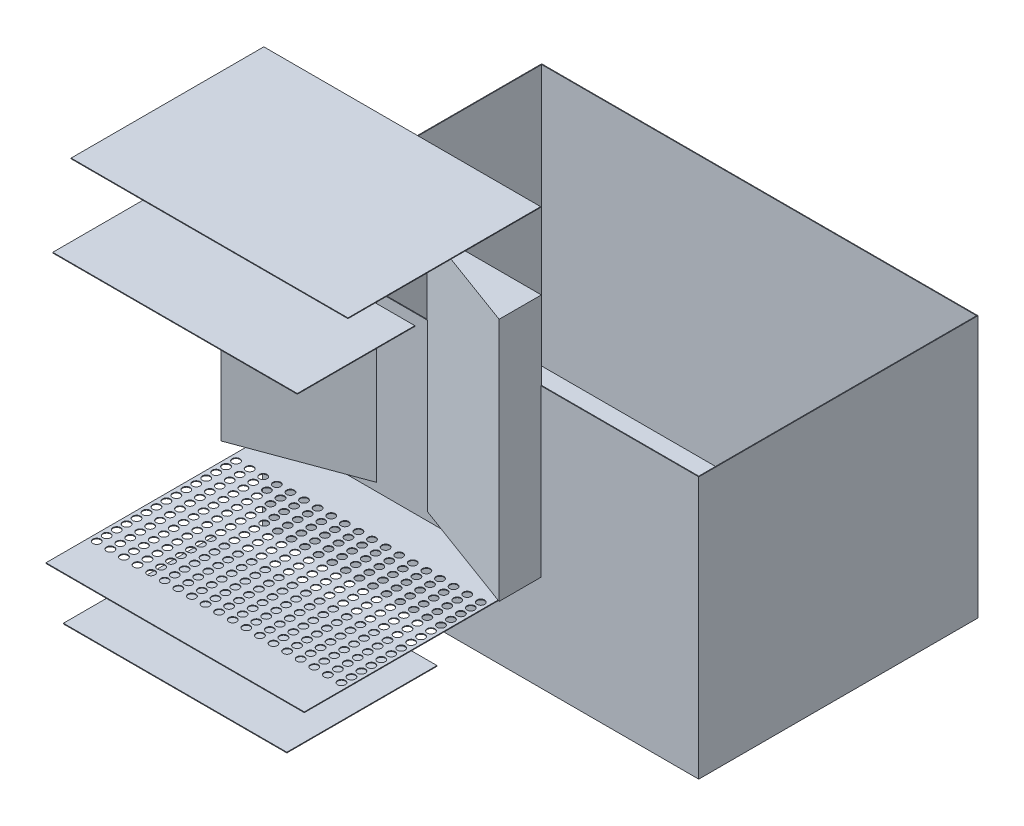
from build123d import *

# Parameters (mm, degrees)
MASTER_FOOTPRINT_W            = 1250
MASTER_FOOTPRINT_H            = 800
BATH_BASE_PLATE_DEPTH         = 750
BATH_SHELL_2MM_T              = -2
INLET_IMPACT_BAFFLE_START     = 125
SKETCH_1_W                    = 640
SKETCH_1_H                    = 430
INLET_IMPACT_BAFFLE_DEPTH     = 2
DISTRIBUTOR_D22_START         = 250
SKETCH_2_W                    = 740
SKETCH_2_H                    = 652
SKETCH_2_R                    = 11
DISTRIBUTOR_D22_DEPTH         = 2
OUTLET_SUBMERGED_BAFFLE_START = 1030
SKETCH_3_W                    = 700.526315789
SKETCH_3_H                    = 336.5
OUTLET_SUBMERGED_BAFFLE_DEPTH = 2
OVERFLOW_WEIR_Z550_START      = 1190
SKETCH_4_W                    = 793
SKETCH_4_H                    = 552
OVERFLOW_WEIR_Z550_DEPTH      = 2
SLOPED_SEDIMENT_FLOOR_START   = 275
SLOPED_SEDIMENT_FLOOR_DEPTH   = 700


with BuildPart() as part:
    # MASTER_FOOTPRINT → BATH_BASE_PLATE (new body)
    with BuildSketch(Plane(origin=(0, 0, 0), x_dir=(1, 0, 0), z_dir=(0, 1, 0))):
        with Locations((625, 400)):
            Rectangle(MASTER_FOOTPRINT_W, MASTER_FOOTPRINT_H)
    extrude(amount=BATH_BASE_PLATE_DEPTH)

    # BATH_SHELL_2MM
    bath_shell_2mm_openings = [part.faces().sort_by_distance(p)[0] for p in [
        (625, 750, -400),
    ]]
    offset(amount=BATH_SHELL_2MM_T, openings=bath_shell_2mm_openings, kind=Kind.INTERSECTION)

    # Эскиз5 → SLOPED_SEDIMENT_FLOOR (add)
    with BuildSketch(Plane(origin=(0, 0, 0), x_dir=(1, 0, 0), z_dir=(0, 1, 0)).offset(SLOPED_SEDIMENT_FLOOR_START)):
        Polygon((2, 1), (2, -120), (330, 1), align=None)
        Polygon((798, 1), (798, -120), (470, 1), align=None)
    extrude(amount=SLOPED_SEDIMENT_FLOOR_DEPTH)


with BuildPart() as body_2:
    # Эскиз1 → INLET_IMPACT_BAFFLE (new body)
    with BuildSketch(Plane(origin=(0, 0, 0), x_dir=(1, 0, 0), z_dir=(0, 1, 0)).offset(INLET_IMPACT_BAFFLE_START)):
        with Locations((400, -435)):
            Rectangle(SKETCH_1_W, SKETCH_1_H)
    extrude(amount=INLET_IMPACT_BAFFLE_DEPTH)


with BuildPart() as body_3:
    # Эскиз2 → DISTRIBUTOR_D22 (new body)
    with BuildSketch(Plane(origin=(0, 0, 0), x_dir=(1, 0, 0), z_dir=(0, 1, 0)).offset(DISTRIBUTOR_D22_START)):
        with Locations((400, -324)):
            Rectangle(SKETCH_2_W, SKETCH_2_H)
        with Locations(Location((49.473684211, -125, 0), (0, 0, 270))):
            Circle(SKETCH_2_R, mode=Mode.SUBTRACT)
        with Locations(Location((49.473684211, -153.5, 0), (0, 0, 270))):
            Circle(SKETCH_2_R, mode=Mode.SUBTRACT)
        with Locations(Location((49.473684211, -182, 0), (0, 0, 270))):
            Circle(SKETCH_2_R, mode=Mode.SUBTRACT)
        with Locations(Location((49.473684211, -210.5, 0), (0, 0, 270))):
            Circle(SKETCH_2_R, mode=Mode.SUBTRACT)
        with Locations(Location((49.473684211, -239, 0), (0, 0, 270))):
            Circle(SKETCH_2_R, mode=Mode.SUBTRACT)
        with Locations(Location((49.473684211, -267.5, 0), (0, 0, 270))):
            Circle(SKETCH_2_R, mode=Mode.SUBTRACT)
        with Locations(Location((49.473684211, -296, 0), (0, 0, 270))):
            Circle(SKETCH_2_R, mode=Mode.SUBTRACT)
        with Locations(Location((49.473684211, -324.5, 0), (0, 0, 270))):
            Circle(SKETCH_2_R, mode=Mode.SUBTRACT)
        with Locations(Location((49.473684211, -353, 0), (0, 0, 270))):
            Circle(SKETCH_2_R, mode=Mode.SUBTRACT)
        with Locations(Location((49.473684211, -381.5, 0), (0, 0, 270))):
            Circle(SKETCH_2_R, mode=Mode.SUBTRACT)
        with Locations(Location((49.473684211, -410, 0), (0, 0, 270))):
            Circle(SKETCH_2_R, mode=Mode.SUBTRACT)
        with Locations(Location((49.473684211, -438.5, 0), (0, 0, 270))):
            Circle(SKETCH_2_R, mode=Mode.SUBTRACT)
        with Locations(Location((49.473684211, -467, 0), (0, 0, 270))):
            Circle(SKETCH_2_R, mode=Mode.SUBTRACT)
        with Locations(Location((49.473684211, -495.5, 0), (0, 0, 270))):
            Circle(SKETCH_2_R, mode=Mode.SUBTRACT)
        with Locations(Location((49.473684211, -524, 0), (0, 0, 270))):
            Circle(SKETCH_2_R, mode=Mode.SUBTRACT)
        with Locations(Location((88.421052632, -125, 0), (0, 0, 270))):
            Circle(SKETCH_2_R, mode=Mode.SUBTRACT)
        with Locations(Location((88.421052632, -153.5, 0), (0, 0, 270))):
            Circle(SKETCH_2_R, mode=Mode.SUBTRACT)
        with Locations(Location((88.421052632, -182, 0), (0, 0, 270))):
            Circle(SKETCH_2_R, mode=Mode.SUBTRACT)
        with Locations(Location((88.421052632, -210.5, 0), (0, 0, 270))):
            Circle(SKETCH_2_R, mode=Mode.SUBTRACT)
        with Locations(Location((88.421052632, -239, 0), (0, 0, 270))):
            Circle(SKETCH_2_R, mode=Mode.SUBTRACT)
        with Locations(Location((88.421052632, -267.5, 0), (0, 0, 270))):
            Circle(SKETCH_2_R, mode=Mode.SUBTRACT)
        with Locations(Location((88.421052632, -296, 0), (0, 0, 270))):
            Circle(SKETCH_2_R, mode=Mode.SUBTRACT)
        with Locations(Location((88.421052632, -324.5, 0), (0, 0, 270))):
            Circle(SKETCH_2_R, mode=Mode.SUBTRACT)
        with Locations(Location((88.421052632, -353, 0), (0, 0, 270))):
            Circle(SKETCH_2_R, mode=Mode.SUBTRACT)
        with Locations(Location((88.421052632, -381.5, 0), (0, 0, 270))):
            Circle(SKETCH_2_R, mode=Mode.SUBTRACT)
        with Locations(Location((88.421052632, -410, 0), (0, 0, 270))):
            Circle(SKETCH_2_R, mode=Mode.SUBTRACT)
        with Locations(Location((88.421052632, -438.5, 0), (0, 0, 270))):
            Circle(SKETCH_2_R, mode=Mode.SUBTRACT)
        with Locations(Location((88.421052632, -467, 0), (0, 0, 270))):
            Circle(SKETCH_2_R, mode=Mode.SUBTRACT)
        with Locations(Location((88.421052632, -495.5, 0), (0, 0, 270))):
            Circle(SKETCH_2_R, mode=Mode.SUBTRACT)
        with Locations(Location((88.421052632, -524, 0), (0, 0, 270))):
            Circle(SKETCH_2_R, mode=Mode.SUBTRACT)
        with Locations(Location((127.368421053, -125, 0), (0, 0, 270))):
            Circle(SKETCH_2_R, mode=Mode.SUBTRACT)
        with Locations(Location((127.368421053, -153.5, 0), (0, 0, 270))):
            Circle(SKETCH_2_R, mode=Mode.SUBTRACT)
        with Locations(Location((127.368421053, -182, 0), (0, 0, 270))):
            Circle(SKETCH_2_R, mode=Mode.SUBTRACT)
        with Locations(Location((127.368421053, -210.5, 0), (0, 0, 270))):
            Circle(SKETCH_2_R, mode=Mode.SUBTRACT)
        with Locations(Location((127.368421053, -239, 0), (0, 0, 270))):
            Circle(SKETCH_2_R, mode=Mode.SUBTRACT)
        with Locations(Location((127.368421053, -267.5, 0), (0, 0, 270))):
            Circle(SKETCH_2_R, mode=Mode.SUBTRACT)
        with Locations(Location((127.368421053, -296, 0), (0, 0, 270))):
            Circle(SKETCH_2_R, mode=Mode.SUBTRACT)
        with Locations(Location((127.368421053, -324.5, 0), (0, 0, 270))):
            Circle(SKETCH_2_R, mode=Mode.SUBTRACT)
        with Locations(Location((127.368421053, -353, 0), (0, 0, 270))):
            Circle(SKETCH_2_R, mode=Mode.SUBTRACT)
        with Locations(Location((127.368421053, -381.5, 0), (0, 0, 270))):
            Circle(SKETCH_2_R, mode=Mode.SUBTRACT)
        with Locations(Location((127.368421053, -410, 0), (0, 0, 270))):
            Circle(SKETCH_2_R, mode=Mode.SUBTRACT)
        with Locations(Location((127.368421053, -438.5, 0), (0, 0, 270))):
            Circle(SKETCH_2_R, mode=Mode.SUBTRACT)
        with Locations(Location((127.368421053, -467, 0), (0, 0, 270))):
            Circle(SKETCH_2_R, mode=Mode.SUBTRACT)
        with Locations(Location((127.368421053, -495.5, 0), (0, 0, 270))):
            Circle(SKETCH_2_R, mode=Mode.SUBTRACT)
        with Locations(Location((127.368421053, -524, 0), (0, 0, 270))):
            Circle(SKETCH_2_R, mode=Mode.SUBTRACT)
        with Locations(Location((166.315789474, -125, 0), (0, 0, 270))):
            Circle(SKETCH_2_R, mode=Mode.SUBTRACT)
        with Locations(Location((166.315789474, -153.5, 0), (0, 0, 270))):
            Circle(SKETCH_2_R, mode=Mode.SUBTRACT)
        with Locations(Location((166.315789474, -182, 0), (0, 0, 270))):
            Circle(SKETCH_2_R, mode=Mode.SUBTRACT)
        with Locations(Location((166.315789474, -210.5, 0), (0, 0, 270))):
            Circle(SKETCH_2_R, mode=Mode.SUBTRACT)
        with Locations(Location((166.315789474, -239, 0), (0, 0, 270))):
            Circle(SKETCH_2_R, mode=Mode.SUBTRACT)
        with Locations(Location((166.315789474, -267.5, 0), (0, 0, 270))):
            Circle(SKETCH_2_R, mode=Mode.SUBTRACT)
        with Locations(Location((166.315789474, -296, 0), (0, 0, 270))):
            Circle(SKETCH_2_R, mode=Mode.SUBTRACT)
        with Locations(Location((166.315789474, -324.5, 0), (0, 0, 270))):
            Circle(SKETCH_2_R, mode=Mode.SUBTRACT)
        with Locations(Location((166.315789474, -353, 0), (0, 0, 270))):
            Circle(SKETCH_2_R, mode=Mode.SUBTRACT)
        with Locations(Location((166.315789474, -381.5, 0), (0, 0, 270))):
            Circle(SKETCH_2_R, mode=Mode.SUBTRACT)
        with Locations(Location((166.315789474, -410, 0), (0, 0, 270))):
            Circle(SKETCH_2_R, mode=Mode.SUBTRACT)
        with Locations(Location((166.315789474, -438.5, 0), (0, 0, 270))):
            Circle(SKETCH_2_R, mode=Mode.SUBTRACT)
        with Locations(Location((166.315789474, -467, 0), (0, 0, 270))):
            Circle(SKETCH_2_R, mode=Mode.SUBTRACT)
        with Locations(Location((166.315789474, -495.5, 0), (0, 0, 270))):
            Circle(SKETCH_2_R, mode=Mode.SUBTRACT)
        with Locations(Location((166.315789474, -524, 0), (0, 0, 270))):
            Circle(SKETCH_2_R, mode=Mode.SUBTRACT)
        with Locations(Location((205.263157895, -125, 0), (0, 0, 270))):
            Circle(SKETCH_2_R, mode=Mode.SUBTRACT)
        with Locations(Location((205.263157895, -153.5, 0), (0, 0, 270))):
            Circle(SKETCH_2_R, mode=Mode.SUBTRACT)
        with Locations(Location((205.263157895, -182, 0), (0, 0, 270))):
            Circle(SKETCH_2_R, mode=Mode.SUBTRACT)
        with Locations(Location((205.263157895, -210.5, 0), (0, 0, 270))):
            Circle(SKETCH_2_R, mode=Mode.SUBTRACT)
        with Locations(Location((205.263157895, -239, 0), (0, 0, 270))):
            Circle(SKETCH_2_R, mode=Mode.SUBTRACT)
        with Locations(Location((205.263157895, -267.5, 0), (0, 0, 270))):
            Circle(SKETCH_2_R, mode=Mode.SUBTRACT)
        with Locations(Location((205.263157895, -296, 0), (0, 0, 270))):
            Circle(SKETCH_2_R, mode=Mode.SUBTRACT)
        with Locations(Location((205.263157895, -324.5, 0), (0, 0, 270))):
            Circle(SKETCH_2_R, mode=Mode.SUBTRACT)
        with Locations(Location((205.263157895, -353, 0), (0, 0, 270))):
            Circle(SKETCH_2_R, mode=Mode.SUBTRACT)
        with Locations(Location((205.263157895, -381.5, 0), (0, 0, 270))):
            Circle(SKETCH_2_R, mode=Mode.SUBTRACT)
        with Locations(Location((205.263157895, -410, 0), (0, 0, 270))):
            Circle(SKETCH_2_R, mode=Mode.SUBTRACT)
        with Locations(Location((205.263157895, -438.5, 0), (0, 0, 270))):
            Circle(SKETCH_2_R, mode=Mode.SUBTRACT)
        with Locations(Location((205.263157895, -467, 0), (0, 0, 270))):
            Circle(SKETCH_2_R, mode=Mode.SUBTRACT)
        with Locations(Location((205.263157895, -495.5, 0), (0, 0, 270))):
            Circle(SKETCH_2_R, mode=Mode.SUBTRACT)
        with Locations(Location((205.263157895, -524, 0), (0, 0, 270))):
            Circle(SKETCH_2_R, mode=Mode.SUBTRACT)
        with Locations(Location((244.210526316, -125, 0), (0, 0, 270))):
            Circle(SKETCH_2_R, mode=Mode.SUBTRACT)
        with Locations(Location((244.210526316, -153.5, 0), (0, 0, 270))):
            Circle(SKETCH_2_R, mode=Mode.SUBTRACT)
        with Locations(Location((244.210526316, -182, 0), (0, 0, 270))):
            Circle(SKETCH_2_R, mode=Mode.SUBTRACT)
        with Locations(Location((244.210526316, -210.5, 0), (0, 0, 270))):
            Circle(SKETCH_2_R, mode=Mode.SUBTRACT)
        with Locations(Location((244.210526316, -239, 0), (0, 0, 270))):
            Circle(SKETCH_2_R, mode=Mode.SUBTRACT)
        with Locations(Location((244.210526316, -267.5, 0), (0, 0, 270))):
            Circle(SKETCH_2_R, mode=Mode.SUBTRACT)
        with Locations(Location((244.210526316, -296, 0), (0, 0, 270))):
            Circle(SKETCH_2_R, mode=Mode.SUBTRACT)
        with Locations(Location((244.210526316, -324.5, 0), (0, 0, 270))):
            Circle(SKETCH_2_R, mode=Mode.SUBTRACT)
        with Locations(Location((244.210526316, -353, 0), (0, 0, 270))):
            Circle(SKETCH_2_R, mode=Mode.SUBTRACT)
        with Locations(Location((244.210526316, -381.5, 0), (0, 0, 270))):
            Circle(SKETCH_2_R, mode=Mode.SUBTRACT)
        with Locations(Location((244.210526316, -410, 0), (0, 0, 270))):
            Circle(SKETCH_2_R, mode=Mode.SUBTRACT)
        with Locations(Location((244.210526316, -438.5, 0), (0, 0, 270))):
            Circle(SKETCH_2_R, mode=Mode.SUBTRACT)
        with Locations(Location((244.210526316, -467, 0), (0, 0, 270))):
            Circle(SKETCH_2_R, mode=Mode.SUBTRACT)
        with Locations(Location((244.210526316, -495.5, 0), (0, 0, 270))):
            Circle(SKETCH_2_R, mode=Mode.SUBTRACT)
        with Locations(Location((244.210526316, -524, 0), (0, 0, 270))):
            Circle(SKETCH_2_R, mode=Mode.SUBTRACT)
        with Locations(Location((283.157894737, -125, 0), (0, 0, 270))):
            Circle(SKETCH_2_R, mode=Mode.SUBTRACT)
        with Locations(Location((283.157894737, -153.5, 0), (0, 0, 270))):
            Circle(SKETCH_2_R, mode=Mode.SUBTRACT)
        with Locations(Location((283.157894737, -182, 0), (0, 0, 270))):
            Circle(SKETCH_2_R, mode=Mode.SUBTRACT)
        with Locations(Location((283.157894737, -210.5, 0), (0, 0, 270))):
            Circle(SKETCH_2_R, mode=Mode.SUBTRACT)
        with Locations(Location((283.157894737, -239, 0), (0, 0, 270))):
            Circle(SKETCH_2_R, mode=Mode.SUBTRACT)
        with Locations(Location((283.157894737, -267.5, 0), (0, 0, 270))):
            Circle(SKETCH_2_R, mode=Mode.SUBTRACT)
        with Locations(Location((283.157894737, -296, 0), (0, 0, 270))):
            Circle(SKETCH_2_R, mode=Mode.SUBTRACT)
        with Locations(Location((283.157894737, -324.5, 0), (0, 0, 270))):
            Circle(SKETCH_2_R, mode=Mode.SUBTRACT)
        with Locations(Location((283.157894737, -353, 0), (0, 0, 270))):
            Circle(SKETCH_2_R, mode=Mode.SUBTRACT)
        with Locations(Location((283.157894737, -381.5, 0), (0, 0, 270))):
            Circle(SKETCH_2_R, mode=Mode.SUBTRACT)
        with Locations(Location((283.157894737, -410, 0), (0, 0, 270))):
            Circle(SKETCH_2_R, mode=Mode.SUBTRACT)
        with Locations(Location((283.157894737, -438.5, 0), (0, 0, 270))):
            Circle(SKETCH_2_R, mode=Mode.SUBTRACT)
        with Locations(Location((283.157894737, -467, 0), (0, 0, 270))):
            Circle(SKETCH_2_R, mode=Mode.SUBTRACT)
        with Locations(Location((283.157894737, -495.5, 0), (0, 0, 270))):
            Circle(SKETCH_2_R, mode=Mode.SUBTRACT)
        with Locations(Location((283.157894737, -524, 0), (0, 0, 270))):
            Circle(SKETCH_2_R, mode=Mode.SUBTRACT)
        with Locations(Location((322.105263158, -125, 0), (0, 0, 270))):
            Circle(SKETCH_2_R, mode=Mode.SUBTRACT)
        with Locations(Location((322.105263158, -153.5, 0), (0, 0, 270))):
            Circle(SKETCH_2_R, mode=Mode.SUBTRACT)
        with Locations(Location((322.105263158, -182, 0), (0, 0, 270))):
            Circle(SKETCH_2_R, mode=Mode.SUBTRACT)
        with Locations(Location((322.105263158, -210.5, 0), (0, 0, 270))):
            Circle(SKETCH_2_R, mode=Mode.SUBTRACT)
        with Locations(Location((322.105263158, -239, 0), (0, 0, 270))):
            Circle(SKETCH_2_R, mode=Mode.SUBTRACT)
        with Locations(Location((322.105263158, -267.5, 0), (0, 0, 270))):
            Circle(SKETCH_2_R, mode=Mode.SUBTRACT)
        with Locations(Location((322.105263158, -296, 0), (0, 0, 270))):
            Circle(SKETCH_2_R, mode=Mode.SUBTRACT)
        with Locations(Location((322.105263158, -324.5, 0), (0, 0, 270))):
            Circle(SKETCH_2_R, mode=Mode.SUBTRACT)
        with Locations(Location((322.105263158, -353, 0), (0, 0, 270))):
            Circle(SKETCH_2_R, mode=Mode.SUBTRACT)
        with Locations(Location((322.105263158, -381.5, 0), (0, 0, 270))):
            Circle(SKETCH_2_R, mode=Mode.SUBTRACT)
        with Locations(Location((322.105263158, -410, 0), (0, 0, 270))):
            Circle(SKETCH_2_R, mode=Mode.SUBTRACT)
        with Locations(Location((322.105263158, -438.5, 0), (0, 0, 270))):
            Circle(SKETCH_2_R, mode=Mode.SUBTRACT)
        with Locations(Location((322.105263158, -467, 0), (0, 0, 270))):
            Circle(SKETCH_2_R, mode=Mode.SUBTRACT)
        with Locations(Location((322.105263158, -495.5, 0), (0, 0, 270))):
            Circle(SKETCH_2_R, mode=Mode.SUBTRACT)
        with Locations(Location((322.105263158, -524, 0), (0, 0, 270))):
            Circle(SKETCH_2_R, mode=Mode.SUBTRACT)
        with Locations(Location((361.052631579, -125, 0), (0, 0, 270))):
            Circle(SKETCH_2_R, mode=Mode.SUBTRACT)
        with Locations(Location((361.052631579, -153.5, 0), (0, 0, 270))):
            Circle(SKETCH_2_R, mode=Mode.SUBTRACT)
        with Locations(Location((361.052631579, -182, 0), (0, 0, 270))):
            Circle(SKETCH_2_R, mode=Mode.SUBTRACT)
        with Locations(Location((361.052631579, -210.5, 0), (0, 0, 270))):
            Circle(SKETCH_2_R, mode=Mode.SUBTRACT)
        with Locations(Location((361.052631579, -239, 0), (0, 0, 270))):
            Circle(SKETCH_2_R, mode=Mode.SUBTRACT)
        with Locations(Location((361.052631579, -267.5, 0), (0, 0, 270))):
            Circle(SKETCH_2_R, mode=Mode.SUBTRACT)
        with Locations(Location((361.052631579, -296, 0), (0, 0, 270))):
            Circle(SKETCH_2_R, mode=Mode.SUBTRACT)
        with Locations(Location((361.052631579, -324.5, 0), (0, 0, 270))):
            Circle(SKETCH_2_R, mode=Mode.SUBTRACT)
        with Locations(Location((361.052631579, -353, 0), (0, 0, 270))):
            Circle(SKETCH_2_R, mode=Mode.SUBTRACT)
        with Locations(Location((361.052631579, -381.5, 0), (0, 0, 270))):
            Circle(SKETCH_2_R, mode=Mode.SUBTRACT)
        with Locations(Location((361.052631579, -410, 0), (0, 0, 270))):
            Circle(SKETCH_2_R, mode=Mode.SUBTRACT)
        with Locations(Location((361.052631579, -438.5, 0), (0, 0, 270))):
            Circle(SKETCH_2_R, mode=Mode.SUBTRACT)
        with Locations(Location((361.052631579, -467, 0), (0, 0, 270))):
            Circle(SKETCH_2_R, mode=Mode.SUBTRACT)
        with Locations(Location((361.052631579, -495.5, 0), (0, 0, 270))):
            Circle(SKETCH_2_R, mode=Mode.SUBTRACT)
        with Locations(Location((361.052631579, -524, 0), (0, 0, 270))):
            Circle(SKETCH_2_R, mode=Mode.SUBTRACT)
        with Locations(Location((400, -125, 0), (0, 0, 270))):
            Circle(SKETCH_2_R, mode=Mode.SUBTRACT)
        with Locations(Location((400, -153.5, 0), (0, 0, 270))):
            Circle(SKETCH_2_R, mode=Mode.SUBTRACT)
        with Locations(Location((400, -182, 0), (0, 0, 270))):
            Circle(SKETCH_2_R, mode=Mode.SUBTRACT)
        with Locations(Location((400, -210.5, 0), (0, 0, 270))):
            Circle(SKETCH_2_R, mode=Mode.SUBTRACT)
        with Locations(Location((400, -239, 0), (0, 0, 270))):
            Circle(SKETCH_2_R, mode=Mode.SUBTRACT)
        with Locations(Location((400, -267.5, 0), (0, 0, 270))):
            Circle(SKETCH_2_R, mode=Mode.SUBTRACT)
        with Locations(Location((400, -296, 0), (0, 0, 270))):
            Circle(SKETCH_2_R, mode=Mode.SUBTRACT)
        with Locations(Location((400, -324.5, 0), (0, 0, 270))):
            Circle(SKETCH_2_R, mode=Mode.SUBTRACT)
        with Locations(Location((400, -353, 0), (0, 0, 270))):
            Circle(SKETCH_2_R, mode=Mode.SUBTRACT)
        with Locations(Location((400, -381.5, 0), (0, 0, 270))):
            Circle(SKETCH_2_R, mode=Mode.SUBTRACT)
        with Locations(Location((400, -410, 0), (0, 0, 270))):
            Circle(SKETCH_2_R, mode=Mode.SUBTRACT)
        with Locations(Location((400, -438.5, 0), (0, 0, 270))):
            Circle(SKETCH_2_R, mode=Mode.SUBTRACT)
        with Locations(Location((400, -467, 0), (0, 0, 270))):
            Circle(SKETCH_2_R, mode=Mode.SUBTRACT)
        with Locations(Location((400, -495.5, 0), (0, 0, 270))):
            Circle(SKETCH_2_R, mode=Mode.SUBTRACT)
        with Locations(Location((400, -524, 0), (0, 0, 270))):
            Circle(SKETCH_2_R, mode=Mode.SUBTRACT)
        with Locations(Location((438.947368421, -125, 0), (0, 0, 270))):
            Circle(SKETCH_2_R, mode=Mode.SUBTRACT)
        with Locations(Location((438.947368421, -153.5, 0), (0, 0, 270))):
            Circle(SKETCH_2_R, mode=Mode.SUBTRACT)
        with Locations(Location((438.947368421, -182, 0), (0, 0, 270))):
            Circle(SKETCH_2_R, mode=Mode.SUBTRACT)
        with Locations(Location((438.947368421, -210.5, 0), (0, 0, 270))):
            Circle(SKETCH_2_R, mode=Mode.SUBTRACT)
        with Locations(Location((438.947368421, -239, 0), (0, 0, 270))):
            Circle(SKETCH_2_R, mode=Mode.SUBTRACT)
        with Locations(Location((438.947368421, -267.5, 0), (0, 0, 270))):
            Circle(SKETCH_2_R, mode=Mode.SUBTRACT)
        with Locations(Location((438.947368421, -296, 0), (0, 0, 270))):
            Circle(SKETCH_2_R, mode=Mode.SUBTRACT)
        with Locations(Location((438.947368421, -324.5, 0), (0, 0, 270))):
            Circle(SKETCH_2_R, mode=Mode.SUBTRACT)
        with Locations(Location((438.947368421, -353, 0), (0, 0, 270))):
            Circle(SKETCH_2_R, mode=Mode.SUBTRACT)
        with Locations(Location((438.947368421, -381.5, 0), (0, 0, 270))):
            Circle(SKETCH_2_R, mode=Mode.SUBTRACT)
        with Locations(Location((438.947368421, -410, 0), (0, 0, 270))):
            Circle(SKETCH_2_R, mode=Mode.SUBTRACT)
        with Locations(Location((438.947368421, -438.5, 0), (0, 0, 270))):
            Circle(SKETCH_2_R, mode=Mode.SUBTRACT)
        with Locations(Location((438.947368421, -467, 0), (0, 0, 270))):
            Circle(SKETCH_2_R, mode=Mode.SUBTRACT)
        with Locations(Location((438.947368421, -495.5, 0), (0, 0, 270))):
            Circle(SKETCH_2_R, mode=Mode.SUBTRACT)
        with Locations(Location((438.947368421, -524, 0), (0, 0, 270))):
            Circle(SKETCH_2_R, mode=Mode.SUBTRACT)
        with Locations(Location((477.894736842, -125, 0), (0, 0, 270))):
            Circle(SKETCH_2_R, mode=Mode.SUBTRACT)
        with Locations(Location((477.894736842, -153.5, 0), (0, 0, 270))):
            Circle(SKETCH_2_R, mode=Mode.SUBTRACT)
        with Locations(Location((477.894736842, -182, 0), (0, 0, 270))):
            Circle(SKETCH_2_R, mode=Mode.SUBTRACT)
        with Locations(Location((477.894736842, -210.5, 0), (0, 0, 270))):
            Circle(SKETCH_2_R, mode=Mode.SUBTRACT)
        with Locations(Location((477.894736842, -239, 0), (0, 0, 270))):
            Circle(SKETCH_2_R, mode=Mode.SUBTRACT)
        with Locations(Location((477.894736842, -267.5, 0), (0, 0, 270))):
            Circle(SKETCH_2_R, mode=Mode.SUBTRACT)
        with Locations(Location((477.894736842, -296, 0), (0, 0, 270))):
            Circle(SKETCH_2_R, mode=Mode.SUBTRACT)
        with Locations(Location((477.894736842, -324.5, 0), (0, 0, 270))):
            Circle(SKETCH_2_R, mode=Mode.SUBTRACT)
        with Locations(Location((477.894736842, -353, 0), (0, 0, 270))):
            Circle(SKETCH_2_R, mode=Mode.SUBTRACT)
        with Locations(Location((477.894736842, -381.5, 0), (0, 0, 270))):
            Circle(SKETCH_2_R, mode=Mode.SUBTRACT)
        with Locations(Location((477.894736842, -410, 0), (0, 0, 270))):
            Circle(SKETCH_2_R, mode=Mode.SUBTRACT)
        with Locations(Location((477.894736842, -438.5, 0), (0, 0, 270))):
            Circle(SKETCH_2_R, mode=Mode.SUBTRACT)
        with Locations(Location((477.894736842, -467, 0), (0, 0, 270))):
            Circle(SKETCH_2_R, mode=Mode.SUBTRACT)
        with Locations(Location((477.894736842, -495.5, 0), (0, 0, 270))):
            Circle(SKETCH_2_R, mode=Mode.SUBTRACT)
        with Locations(Location((477.894736842, -524, 0), (0, 0, 270))):
            Circle(SKETCH_2_R, mode=Mode.SUBTRACT)
        with Locations(Location((516.842105263, -125, 0), (0, 0, 270))):
            Circle(SKETCH_2_R, mode=Mode.SUBTRACT)
        with Locations(Location((516.842105263, -153.5, 0), (0, 0, 270))):
            Circle(SKETCH_2_R, mode=Mode.SUBTRACT)
        with Locations(Location((516.842105263, -182, 0), (0, 0, 270))):
            Circle(SKETCH_2_R, mode=Mode.SUBTRACT)
        with Locations(Location((516.842105263, -210.5, 0), (0, 0, 270))):
            Circle(SKETCH_2_R, mode=Mode.SUBTRACT)
        with Locations(Location((516.842105263, -239, 0), (0, 0, 270))):
            Circle(SKETCH_2_R, mode=Mode.SUBTRACT)
        with Locations(Location((516.842105263, -267.5, 0), (0, 0, 270))):
            Circle(SKETCH_2_R, mode=Mode.SUBTRACT)
        with Locations(Location((516.842105263, -296, 0), (0, 0, 270))):
            Circle(SKETCH_2_R, mode=Mode.SUBTRACT)
        with Locations(Location((516.842105263, -324.5, 0), (0, 0, 270))):
            Circle(SKETCH_2_R, mode=Mode.SUBTRACT)
        with Locations(Location((516.842105263, -353, 0), (0, 0, 270))):
            Circle(SKETCH_2_R, mode=Mode.SUBTRACT)
        with Locations(Location((516.842105263, -381.5, 0), (0, 0, 270))):
            Circle(SKETCH_2_R, mode=Mode.SUBTRACT)
        with Locations(Location((516.842105263, -410, 0), (0, 0, 270))):
            Circle(SKETCH_2_R, mode=Mode.SUBTRACT)
        with Locations(Location((516.842105263, -438.5, 0), (0, 0, 270))):
            Circle(SKETCH_2_R, mode=Mode.SUBTRACT)
        with Locations(Location((516.842105263, -467, 0), (0, 0, 270))):
            Circle(SKETCH_2_R, mode=Mode.SUBTRACT)
        with Locations(Location((516.842105263, -495.5, 0), (0, 0, 270))):
            Circle(SKETCH_2_R, mode=Mode.SUBTRACT)
        with Locations(Location((516.842105263, -524, 0), (0, 0, 270))):
            Circle(SKETCH_2_R, mode=Mode.SUBTRACT)
        with Locations(Location((555.789473684, -125, 0), (0, 0, 270))):
            Circle(SKETCH_2_R, mode=Mode.SUBTRACT)
        with Locations(Location((555.789473684, -153.5, 0), (0, 0, 270))):
            Circle(SKETCH_2_R, mode=Mode.SUBTRACT)
        with Locations(Location((555.789473684, -182, 0), (0, 0, 270))):
            Circle(SKETCH_2_R, mode=Mode.SUBTRACT)
        with Locations(Location((555.789473684, -210.5, 0), (0, 0, 270))):
            Circle(SKETCH_2_R, mode=Mode.SUBTRACT)
        with Locations(Location((555.789473684, -239, 0), (0, 0, 270))):
            Circle(SKETCH_2_R, mode=Mode.SUBTRACT)
        with Locations(Location((555.789473684, -267.5, 0), (0, 0, 270))):
            Circle(SKETCH_2_R, mode=Mode.SUBTRACT)
        with Locations(Location((555.789473684, -296, 0), (0, 0, 270))):
            Circle(SKETCH_2_R, mode=Mode.SUBTRACT)
        with Locations(Location((555.789473684, -324.5, 0), (0, 0, 270))):
            Circle(SKETCH_2_R, mode=Mode.SUBTRACT)
        with Locations(Location((555.789473684, -353, 0), (0, 0, 270))):
            Circle(SKETCH_2_R, mode=Mode.SUBTRACT)
        with Locations(Location((555.789473684, -381.5, 0), (0, 0, 270))):
            Circle(SKETCH_2_R, mode=Mode.SUBTRACT)
        with Locations(Location((555.789473684, -410, 0), (0, 0, 270))):
            Circle(SKETCH_2_R, mode=Mode.SUBTRACT)
        with Locations(Location((555.789473684, -438.5, 0), (0, 0, 270))):
            Circle(SKETCH_2_R, mode=Mode.SUBTRACT)
        with Locations(Location((555.789473684, -467, 0), (0, 0, 270))):
            Circle(SKETCH_2_R, mode=Mode.SUBTRACT)
        with Locations(Location((555.789473684, -495.5, 0), (0, 0, 270))):
            Circle(SKETCH_2_R, mode=Mode.SUBTRACT)
        with Locations(Location((555.789473684, -524, 0), (0, 0, 270))):
            Circle(SKETCH_2_R, mode=Mode.SUBTRACT)
        with Locations(Location((594.736842105, -125, 0), (0, 0, 270))):
            Circle(SKETCH_2_R, mode=Mode.SUBTRACT)
        with Locations(Location((594.736842105, -153.5, 0), (0, 0, 270))):
            Circle(SKETCH_2_R, mode=Mode.SUBTRACT)
        with Locations(Location((594.736842105, -182, 0), (0, 0, 270))):
            Circle(SKETCH_2_R, mode=Mode.SUBTRACT)
        with Locations(Location((594.736842105, -210.5, 0), (0, 0, 270))):
            Circle(SKETCH_2_R, mode=Mode.SUBTRACT)
        with Locations(Location((594.736842105, -239, 0), (0, 0, 270))):
            Circle(SKETCH_2_R, mode=Mode.SUBTRACT)
        with Locations(Location((594.736842105, -267.5, 0), (0, 0, 270))):
            Circle(SKETCH_2_R, mode=Mode.SUBTRACT)
        with Locations(Location((594.736842105, -296, 0), (0, 0, 270))):
            Circle(SKETCH_2_R, mode=Mode.SUBTRACT)
        with Locations(Location((594.736842105, -324.5, 0), (0, 0, 270))):
            Circle(SKETCH_2_R, mode=Mode.SUBTRACT)
        with Locations(Location((594.736842105, -353, 0), (0, 0, 270))):
            Circle(SKETCH_2_R, mode=Mode.SUBTRACT)
        with Locations(Location((594.736842105, -381.5, 0), (0, 0, 270))):
            Circle(SKETCH_2_R, mode=Mode.SUBTRACT)
        with Locations(Location((594.736842105, -410, 0), (0, 0, 270))):
            Circle(SKETCH_2_R, mode=Mode.SUBTRACT)
        with Locations(Location((594.736842105, -438.5, 0), (0, 0, 270))):
            Circle(SKETCH_2_R, mode=Mode.SUBTRACT)
        with Locations(Location((594.736842105, -467, 0), (0, 0, 270))):
            Circle(SKETCH_2_R, mode=Mode.SUBTRACT)
        with Locations(Location((594.736842105, -495.5, 0), (0, 0, 270))):
            Circle(SKETCH_2_R, mode=Mode.SUBTRACT)
        with Locations(Location((594.736842105, -524, 0), (0, 0, 270))):
            Circle(SKETCH_2_R, mode=Mode.SUBTRACT)
        with Locations(Location((633.684210526, -125, 0), (0, 0, 270))):
            Circle(SKETCH_2_R, mode=Mode.SUBTRACT)
        with Locations(Location((633.684210526, -153.5, 0), (0, 0, 270))):
            Circle(SKETCH_2_R, mode=Mode.SUBTRACT)
        with Locations(Location((633.684210526, -182, 0), (0, 0, 270))):
            Circle(SKETCH_2_R, mode=Mode.SUBTRACT)
        with Locations(Location((633.684210526, -210.5, 0), (0, 0, 270))):
            Circle(SKETCH_2_R, mode=Mode.SUBTRACT)
        with Locations(Location((633.684210526, -239, 0), (0, 0, 270))):
            Circle(SKETCH_2_R, mode=Mode.SUBTRACT)
        with Locations(Location((633.684210526, -267.5, 0), (0, 0, 270))):
            Circle(SKETCH_2_R, mode=Mode.SUBTRACT)
        with Locations(Location((633.684210526, -296, 0), (0, 0, 270))):
            Circle(SKETCH_2_R, mode=Mode.SUBTRACT)
        with Locations(Location((633.684210526, -324.5, 0), (0, 0, 270))):
            Circle(SKETCH_2_R, mode=Mode.SUBTRACT)
        with Locations(Location((633.684210526, -353, 0), (0, 0, 270))):
            Circle(SKETCH_2_R, mode=Mode.SUBTRACT)
        with Locations(Location((633.684210526, -381.5, 0), (0, 0, 270))):
            Circle(SKETCH_2_R, mode=Mode.SUBTRACT)
        with Locations(Location((633.684210526, -410, 0), (0, 0, 270))):
            Circle(SKETCH_2_R, mode=Mode.SUBTRACT)
        with Locations(Location((633.684210526, -438.5, 0), (0, 0, 270))):
            Circle(SKETCH_2_R, mode=Mode.SUBTRACT)
        with Locations(Location((633.684210526, -467, 0), (0, 0, 270))):
            Circle(SKETCH_2_R, mode=Mode.SUBTRACT)
        with Locations(Location((633.684210526, -495.5, 0), (0, 0, 270))):
            Circle(SKETCH_2_R, mode=Mode.SUBTRACT)
        with Locations(Location((633.684210526, -524, 0), (0, 0, 270))):
            Circle(SKETCH_2_R, mode=Mode.SUBTRACT)
        with Locations(Location((672.631578947, -125, 0), (0, 0, 270))):
            Circle(SKETCH_2_R, mode=Mode.SUBTRACT)
        with Locations(Location((672.631578947, -153.5, 0), (0, 0, 270))):
            Circle(SKETCH_2_R, mode=Mode.SUBTRACT)
        with Locations(Location((672.631578947, -182, 0), (0, 0, 270))):
            Circle(SKETCH_2_R, mode=Mode.SUBTRACT)
        with Locations(Location((672.631578947, -210.5, 0), (0, 0, 270))):
            Circle(SKETCH_2_R, mode=Mode.SUBTRACT)
        with Locations(Location((672.631578947, -239, 0), (0, 0, 270))):
            Circle(SKETCH_2_R, mode=Mode.SUBTRACT)
        with Locations(Location((672.631578947, -267.5, 0), (0, 0, 270))):
            Circle(SKETCH_2_R, mode=Mode.SUBTRACT)
        with Locations(Location((672.631578947, -296, 0), (0, 0, 270))):
            Circle(SKETCH_2_R, mode=Mode.SUBTRACT)
        with Locations(Location((672.631578947, -324.5, 0), (0, 0, 270))):
            Circle(SKETCH_2_R, mode=Mode.SUBTRACT)
        with Locations(Location((672.631578947, -353, 0), (0, 0, 270))):
            Circle(SKETCH_2_R, mode=Mode.SUBTRACT)
        with Locations(Location((672.631578947, -381.5, 0), (0, 0, 270))):
            Circle(SKETCH_2_R, mode=Mode.SUBTRACT)
        with Locations(Location((672.631578947, -410, 0), (0, 0, 270))):
            Circle(SKETCH_2_R, mode=Mode.SUBTRACT)
        with Locations(Location((672.631578947, -438.5, 0), (0, 0, 270))):
            Circle(SKETCH_2_R, mode=Mode.SUBTRACT)
        with Locations(Location((672.631578947, -467, 0), (0, 0, 270))):
            Circle(SKETCH_2_R, mode=Mode.SUBTRACT)
        with Locations(Location((672.631578947, -495.5, 0), (0, 0, 270))):
            Circle(SKETCH_2_R, mode=Mode.SUBTRACT)
        with Locations(Location((672.631578947, -524, 0), (0, 0, 270))):
            Circle(SKETCH_2_R, mode=Mode.SUBTRACT)
        with Locations(Location((711.578947368, -125, 0), (0, 0, 270))):
            Circle(SKETCH_2_R, mode=Mode.SUBTRACT)
        with Locations(Location((711.578947368, -153.5, 0), (0, 0, 270))):
            Circle(SKETCH_2_R, mode=Mode.SUBTRACT)
        with Locations(Location((711.578947368, -182, 0), (0, 0, 270))):
            Circle(SKETCH_2_R, mode=Mode.SUBTRACT)
        with Locations(Location((711.578947368, -210.5, 0), (0, 0, 270))):
            Circle(SKETCH_2_R, mode=Mode.SUBTRACT)
        with Locations(Location((711.578947368, -239, 0), (0, 0, 270))):
            Circle(SKETCH_2_R, mode=Mode.SUBTRACT)
        with Locations(Location((711.578947368, -267.5, 0), (0, 0, 270))):
            Circle(SKETCH_2_R, mode=Mode.SUBTRACT)
        with Locations(Location((711.578947368, -296, 0), (0, 0, 270))):
            Circle(SKETCH_2_R, mode=Mode.SUBTRACT)
        with Locations(Location((711.578947368, -324.5, 0), (0, 0, 270))):
            Circle(SKETCH_2_R, mode=Mode.SUBTRACT)
        with Locations(Location((711.578947368, -353, 0), (0, 0, 270))):
            Circle(SKETCH_2_R, mode=Mode.SUBTRACT)
        with Locations(Location((711.578947368, -381.5, 0), (0, 0, 270))):
            Circle(SKETCH_2_R, mode=Mode.SUBTRACT)
        with Locations(Location((711.578947368, -410, 0), (0, 0, 270))):
            Circle(SKETCH_2_R, mode=Mode.SUBTRACT)
        with Locations(Location((711.578947368, -438.5, 0), (0, 0, 270))):
            Circle(SKETCH_2_R, mode=Mode.SUBTRACT)
        with Locations(Location((711.578947368, -467, 0), (0, 0, 270))):
            Circle(SKETCH_2_R, mode=Mode.SUBTRACT)
        with Locations(Location((711.578947368, -495.5, 0), (0, 0, 270))):
            Circle(SKETCH_2_R, mode=Mode.SUBTRACT)
        with Locations(Location((711.578947368, -524, 0), (0, 0, 270))):
            Circle(SKETCH_2_R, mode=Mode.SUBTRACT)
        with Locations(Location((750.526315789, -125, 0), (0, 0, 270))):
            Circle(SKETCH_2_R, mode=Mode.SUBTRACT)
        with Locations(Location((750.526315789, -153.5, 0), (0, 0, 270))):
            Circle(SKETCH_2_R, mode=Mode.SUBTRACT)
        with Locations(Location((750.526315789, -182, 0), (0, 0, 270))):
            Circle(SKETCH_2_R, mode=Mode.SUBTRACT)
        with Locations(Location((750.526315789, -210.5, 0), (0, 0, 270))):
            Circle(SKETCH_2_R, mode=Mode.SUBTRACT)
        with Locations(Location((750.526315789, -239, 0), (0, 0, 270))):
            Circle(SKETCH_2_R, mode=Mode.SUBTRACT)
        with Locations(Location((750.526315789, -267.5, 0), (0, 0, 270))):
            Circle(SKETCH_2_R, mode=Mode.SUBTRACT)
        with Locations(Location((750.526315789, -296, 0), (0, 0, 270))):
            Circle(SKETCH_2_R, mode=Mode.SUBTRACT)
        with Locations(Location((750.526315789, -324.5, 0), (0, 0, 270))):
            Circle(SKETCH_2_R, mode=Mode.SUBTRACT)
        with Locations(Location((750.526315789, -353, 0), (0, 0, 270))):
            Circle(SKETCH_2_R, mode=Mode.SUBTRACT)
        with Locations(Location((750.526315789, -381.5, 0), (0, 0, 270))):
            Circle(SKETCH_2_R, mode=Mode.SUBTRACT)
        with Locations(Location((750.526315789, -410, 0), (0, 0, 270))):
            Circle(SKETCH_2_R, mode=Mode.SUBTRACT)
        with Locations(Location((750.526315789, -438.5, 0), (0, 0, 270))):
            Circle(SKETCH_2_R, mode=Mode.SUBTRACT)
        with Locations(Location((750.526315789, -467, 0), (0, 0, 270))):
            Circle(SKETCH_2_R, mode=Mode.SUBTRACT)
        with Locations(Location((750.526315789, -495.5, 0), (0, 0, 270))):
            Circle(SKETCH_2_R, mode=Mode.SUBTRACT)
        with Locations(Location((750.526315789, -524, 0), (0, 0, 270))):
            Circle(SKETCH_2_R, mode=Mode.SUBTRACT)
    extrude(amount=DISTRIBUTOR_D22_DEPTH)


with BuildPart() as body_4:
    # Эскиз3 → OUTLET_SUBMERGED_BAFFLE (new body)
    with BuildSketch(Plane(origin=(0, 0, 0), x_dir=(1, 0, 0), z_dir=(0, 1, 0)).offset(OUTLET_SUBMERGED_BAFFLE_START)):
        with Locations((399.736842105, -481.75)):
            Rectangle(SKETCH_3_W, SKETCH_3_H)
    extrude(amount=OUTLET_SUBMERGED_BAFFLE_DEPTH)


with BuildPart() as body_5:
    # Эскиз4 → OVERFLOW_WEIR_Z550 (new body)
    with BuildSketch(Plane(origin=(0, 0, 0), x_dir=(1, 0, 0), z_dir=(0, 1, 0)).offset(OVERFLOW_WEIR_Z550_START)):
        with Locations((398.5, -274)):
            Rectangle(SKETCH_4_W, SKETCH_4_H)
    extrude(amount=OVERFLOW_WEIR_Z550_DEPTH)


solid = Compound([part.part, body_2.part, body_3.part, body_4.part, body_5.part])
